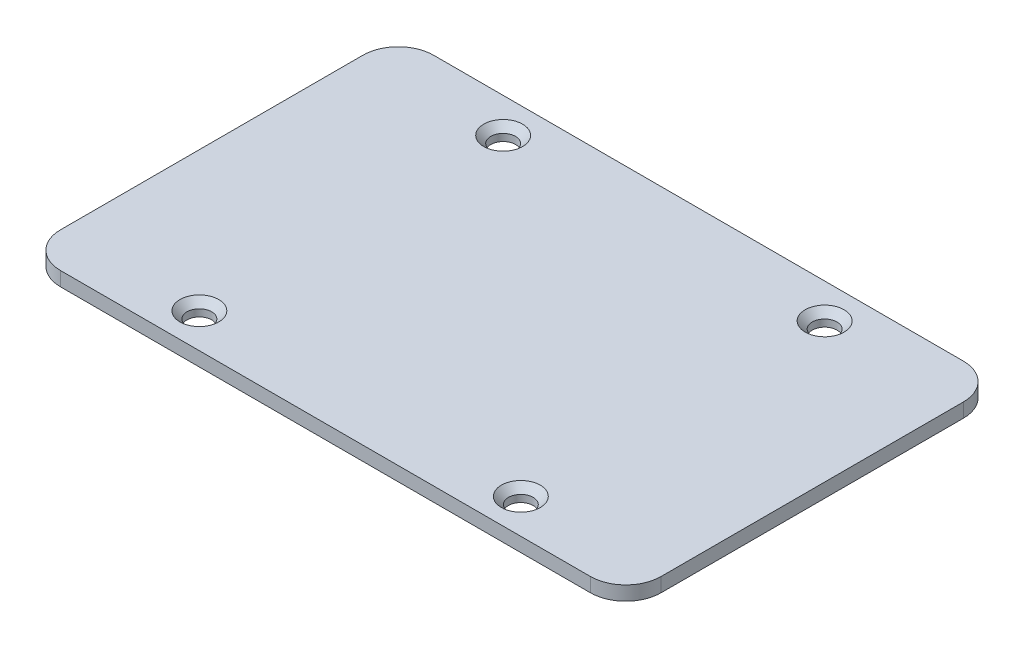
from build123d import *

# Parameters (mm, degrees)
SKETCH1_W           = 85
SKETCH1_H           = 52.8
BOSS_EXTRUDE1_DEPTH = 1
SKETCH2_R           = 1.75
CUT_EXTRUDE1_DEPTH  = 2
CHAMFER1_SIZE       = 1
FILLET2_R           = 5


with BuildPart() as part:
    # Sketch1 → Boss-Extrude1 (new, symmetric)
    with BuildSketch(Plane(origin=(0, 0, 0), x_dir=(1, 0, 0), z_dir=(0, 1, 0))):
        Rectangle(SKETCH1_W, SKETCH1_H)
    extrude(amount=BOSS_EXTRUDE1_DEPTH, both=True)

    # Sketch2 → Cut-Extrude1 (cut)
    with BuildSketch(Plane(origin=(0, 1, 0), x_dir=(1, 0, 0), z_dir=(0, 1, 0))):
        with Locations(Location((-22.75, 21.5, 0), (0, 0, 270))):
            Circle(SKETCH2_R)
        with Locations(Location((22.75, 21.5, 0), (0, 0, 270))):
            Circle(SKETCH2_R)
        with Locations(Location((22.75, -21.5, 0), (0, 0, 270))):
            Circle(SKETCH2_R)
        with Locations(Location((-22.75, -21.5, 0), (0, 0, 270))):
            Circle(SKETCH2_R)
    extrude(amount=-CUT_EXTRUDE1_DEPTH, mode=Mode.SUBTRACT)

    # Chamfer1
    chamfer1_edges = [part.edges().sort_by_distance(p)[0] for p in [
        (-22.75, 1, 19.75),
        (22.75, 1, 19.75),
        (22.75, 1, -23.25),
        (-22.75, 1, -23.25),
    ]]
    chamfer(chamfer1_edges, length=CHAMFER1_SIZE)

    # Fillet2
    fillet2_edges = [part.edges().sort_by_distance(p)[0] for p in [
        (42.5, 0, 26.4),
        (-42.5, 0, 26.4),
        (-42.5, 0, -26.4),
        (42.5, 0, -26.4),
    ]]
    fillet(fillet2_edges, radius=FILLET2_R)


solid = part.part
